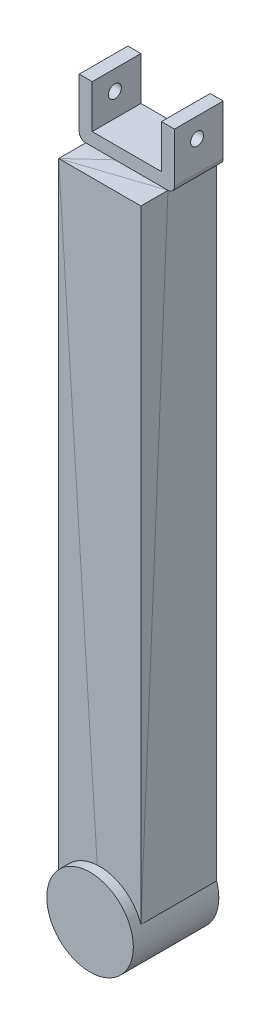
from build123d import *

# Parameters (mm, degrees)
SKETCH1_W                = 38
SKETCH1_H                = 35
BOSS_EXTRUDE1_DEPTH      = 295
BOSS_EXTRUDE3_DEPTH      = 5
BOSS_EXTRUDE3_DEPTH_BACK = 17.5
SKETCH1_3_W              = 38
SKETCH1_3_H              = 35
BOSS_EXTRUDE6_DEPTH      = 295
CUT_EXTRUDE1_START       = -6
SKETCH3_R                = 3
CUT_EXTRUDE1_DEPTH       = 6
BOSS_EXTRUDE8_DEPTH      = 22
BOSS_EXTRUDE8_DEPTH_BACK = 17.5
SKETCH5_R                = 20
SKETCH8_R                = 5
CUT_EXTRUDE2_DEPTH       = 10


with BuildPart() as part:
    # Sketch1 → Boss-Extrude1 (new body)
    with BuildSketch(Plane(origin=(0, 0, 0), x_dir=(1, 0, 0), z_dir=(0, 1, 0))):
        Rectangle(SKETCH1_W, SKETCH1_H)
    extrude(amount=-BOSS_EXTRUDE1_DEPTH)


with BuildPart() as body_2:
    # Sketch2 → Boss-Extrude3 (new, two sides: drawn at the far end of the back side and taken through both)
    with BuildSketch(Plane.XY.offset(-BOSS_EXTRUDE3_DEPTH_BACK)):
        with BuildLine():
            Line((-19, 0), (19, 0))
            ThreePointArc((19, 0), (21.121320344, 0.878679656), (22, 3))
            Line((22, 3), (22, 26))
            Line((22, 26), (16, 26))
            Line((16, 26), (16, 6))
            Line((16, 6), (-16, 6))
            Line((-16, 6), (-16, 26))
            Line((-16, 26), (-22, 26))
            Line((-22, 26), (-22, 3))
            ThreePointArc((-22, 3), (-21.121320344, 0.878679656), (-19, 0))
        make_face()
    extrude(amount=BOSS_EXTRUDE3_DEPTH + BOSS_EXTRUDE3_DEPTH_BACK)

    # Sketch1<3> → Boss-Extrude6 (add)
    with BuildSketch(Plane(origin=(0, 0, 0), x_dir=(1, 0, 0), z_dir=(0, 1, 0))):
        Rectangle(SKETCH1_3_W, SKETCH1_3_H)
    extrude(amount=-BOSS_EXTRUDE6_DEPTH)

    # Sketch3 → Cut-Extrude1 (cut)
    with BuildSketch(Plane.ZY.offset(-16).offset(CUT_EXTRUDE1_START)):
        with Locations((-5.46063237, 16.89632523)):
            Circle(SKETCH3_R)
    cut_extrude1 = extrude(amount=CUT_EXTRUDE1_DEPTH, mode=Mode.SUBTRACT)

    # Mirror1: Cut-Extrude1 across plane
    add(cut_extrude1.mirror(Plane(origin=(0, 0, 0), x_dir=(0, 0, 1), z_dir=(1, 0, 0))), mode=Mode.SUBTRACT)

    # Sketch5 → Boss-Extrude8 (add, two sides: drawn at the far end of the back side and taken through both)
    with BuildSketch(Plane.XY.offset(-BOSS_EXTRUDE8_DEPTH_BACK)):
        with Locations((0, -293.783942795)):
            Circle(SKETCH5_R)
    extrude(amount=BOSS_EXTRUDE8_DEPTH + BOSS_EXTRUDE8_DEPTH_BACK)

    # Sketch8 → Cut-Extrude2 (cut)
    with BuildSketch(Plane.ZY.offset(19)):
        with Locations((0, -85)):
            Circle(SKETCH8_R)
    extrude(amount=-CUT_EXTRUDE2_DEPTH, mode=Mode.SUBTRACT)


solid = Compound([part.part, body_2.part])
